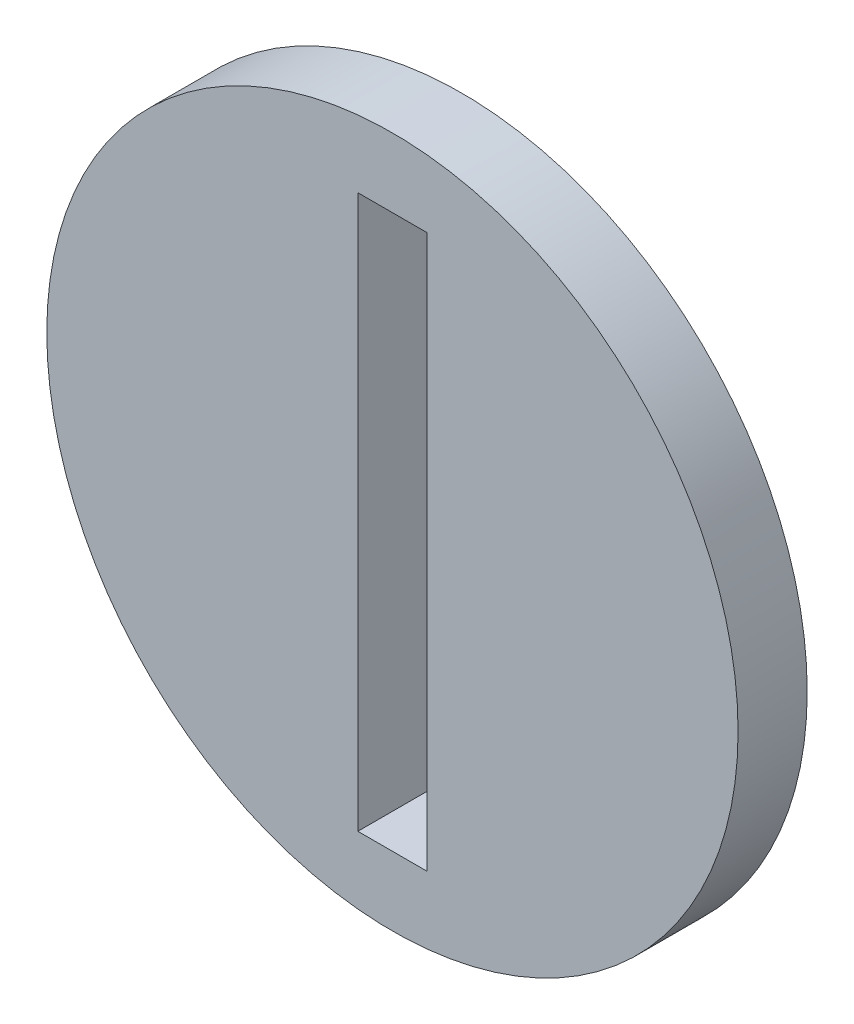
from build123d import *

# Parameters (mm, degrees)
SKETCH1_R           = 15.875
SKETCH1_W           = 3.175
SKETCH1_H           = 25.4
BOSS_EXTRUDE1_DEPTH = 3.175


with BuildPart() as part:
    # Sketch1 → Boss-Extrude1 (new body)
    with BuildSketch(Plane.XY):
        Circle(SKETCH1_R)
        Rectangle(SKETCH1_W, SKETCH1_H, mode=Mode.SUBTRACT)
    extrude(amount=BOSS_EXTRUDE1_DEPTH)


solid = part.part
